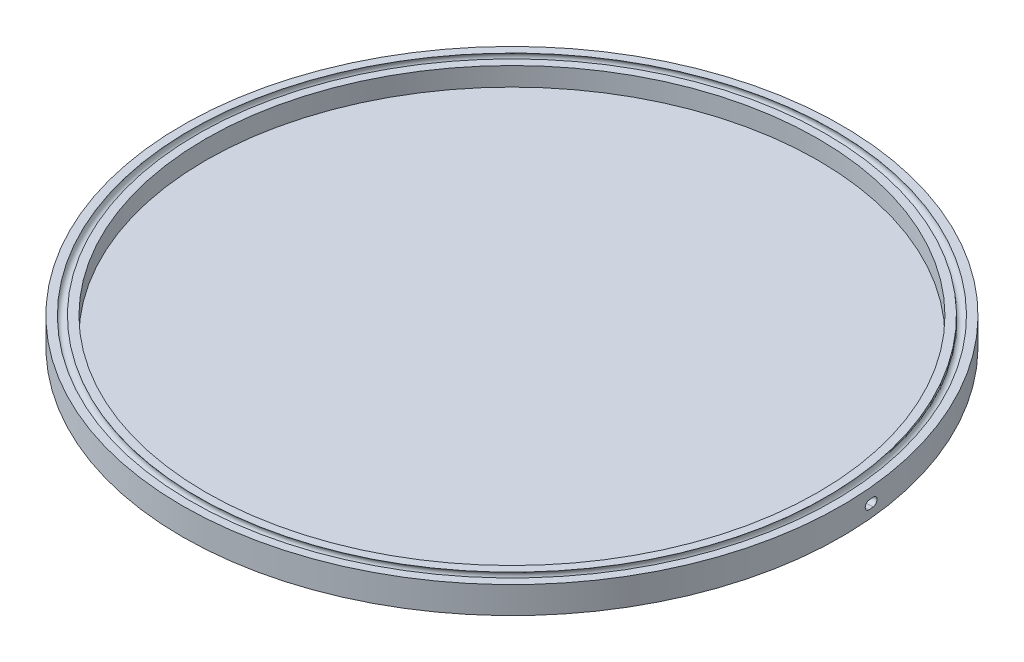
from build123d import *

# Parameters (mm, degrees)
SKETCH1_R               = 141
BOSS_EXTRUDE1_DEPTH     = 3.5
SKETCH2_R               = 141
SKETCH2_R_2             = 131
BOSS_EXTRUDE2_DEPTH     = 8
SKETCH5_R               = 2
CUT_EXTRUDE3_DEPTH      = 5
CUT_EXTRUDE3_DEPTH_BACK = 15


with BuildPart() as part:
    # Sketch1 → Boss-Extrude1 (new body)
    with BuildSketch(Plane(origin=(0, 0, 0), x_dir=(1, 0, 0), z_dir=(0, 1, 0))):
        with Locations(Location((0, 0, 0), (0, 0, 270))):
            Circle(SKETCH1_R)
    extrude(amount=BOSS_EXTRUDE1_DEPTH)

    # Sketch2 → Boss-Extrude2 (add)
    with BuildSketch(Plane(origin=(0, 3.5, 0), x_dir=(1, 0, 0), z_dir=(0, 1, 0))):
        with Locations(Location((0, 0, 0), (0, 0, 270))):
            Circle(SKETCH2_R)
        with Locations(Location((0, 0, 0), (0, 0, 270))):
            Circle(SKETCH2_R_2, mode=Mode.SUBTRACT)
    extrude(amount=BOSS_EXTRUDE2_DEPTH)

    # Cut-Sweep1: sweep along a path in Sketch3
    with BuildLine(Plane(origin=(0, 11.5, 0), x_dir=(1, 0, 0), z_dir=(0, 1, 0))) as cut_sweep1_path:
        CenterArc((0, 0), 136, 0, 360)
    # Sketch5 → Cut-Sweep1 (sweep, cut)
    with BuildSketch(Plane(origin=(0, 0, 0), x_dir=(0.9955256364380607, 0, -0.09449183665584275), z_dir=(0.09449183665584275, 0, 0.9955256364380607))):
        with Locations((136, 10.2)):
            Circle(SKETCH5_R)
    sweep(path=cut_sweep1_path.line, mode=Mode.SUBTRACT)

    # Sketch6 → Cut-Extrude3 (cut, two sides: drawn at the far end of the back side and taken through both)
    with BuildSketch(Plane(origin=(130.413858373, 0, -12.378430602), x_dir=(0.09449183665584276, 0, 0.9955256364380607), z_dir=(-0.9955256364380607, 0, 0.09449183665584276)).offset(-CUT_EXTRUDE3_DEPTH_BACK)):
        with BuildLine():
            Line((1, 3.599112528), (-1, 3.599112528))
            ThreePointArc((-1, 3.599112528), (-2.8, 5.399112528), (-1, 7.199112528))
            Line((-1, 7.199112528), (1, 7.199112528))
            ThreePointArc((1, 7.199112528), (2.8, 5.399112528), (1, 3.599112528))
        make_face()
    extrude(amount=CUT_EXTRUDE3_DEPTH + CUT_EXTRUDE3_DEPTH_BACK, mode=Mode.SUBTRACT)


solid = part.part
